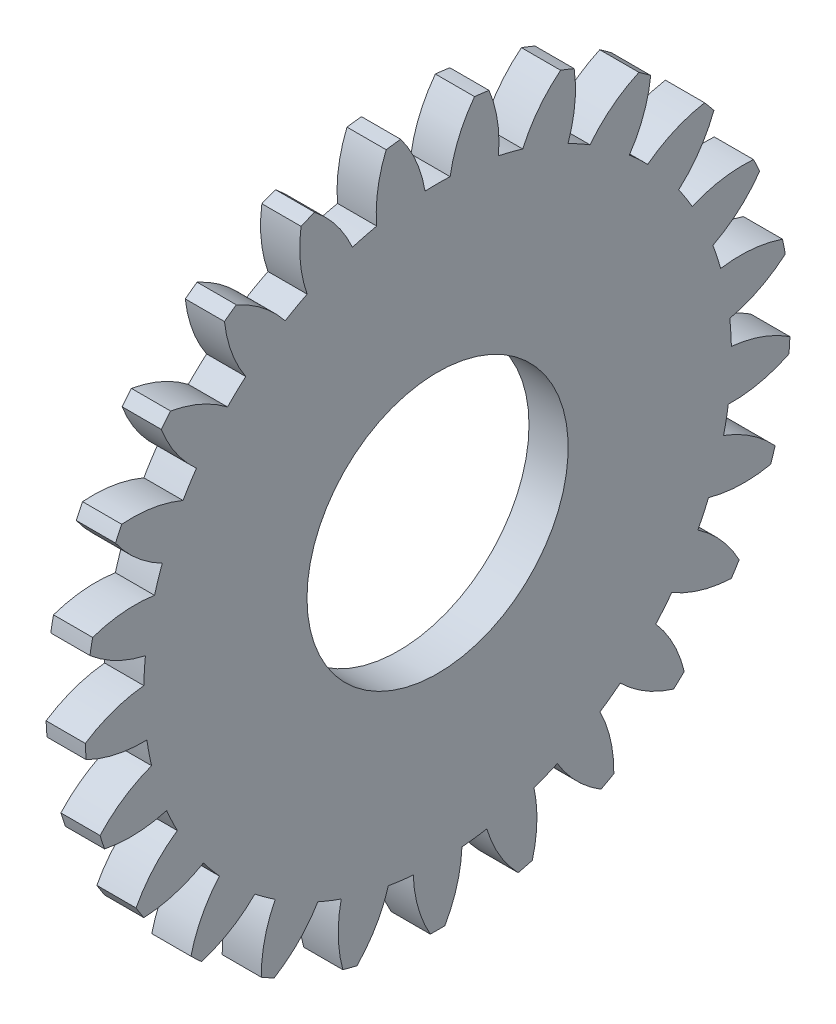
from build123d import *

# Parameters (mm, degrees)
BASPROSKE_W     = 1.5
BASPROSKE_H     = 13.5
TOOTHCUT_DEPTH  = 20.150718002
TEETHCUTS_COUNT = 25
TEETHCUTS_ANGLE = 345.6
BORSKE_R        = 5
BORE_DEPTH      = 50.0000508


with BuildPart() as part:
    # BasProSke → Base-Revolve (revolve)
    with BuildSketch(Plane(origin=(0, 0, 0), x_dir=(1, 0, 0), z_dir=(0, 1, 0)), mode=Mode.PRIVATE) as base_revolve_sk:
        with Locations((0.75, 6.75)):
            Rectangle(BASPROSKE_W, BASPROSKE_H)
    revolve(base_revolve_sk.sketch.rotate(Axis((-10, 0, 0), (1, 0, 0)), 180), axis=Axis((-10, 0, 0), (1, 0, 0)))

    # TooCutSke → ToothCut (cut, through all)
    with BuildSketch(Plane(origin=(0, 0, 0), x_dir=(0, 0, -1), z_dir=(1, 0, 0))):
        with BuildLine():
            ThreePointArc((0.480087995, 11.238750665), (0, 11.249), (-0.480087995, 11.238750665))
            ThreePointArc((-0.480087995, 11.238750665), (-0.821124963, 12.40220054), (-1.432168974, 13.449361962))
            ThreePointArc((-1.432168974, 13.449361962), (0, 13.5254), (1.432168974, 13.449361962))
            ThreePointArc((1.432168974, 13.449361962), (0.821124963, 12.40220054), (0.480087995, 11.238750665))
        make_face()
    toothcut = extrude(amount=TOOTHCUT_DEPTH, mode=Mode.SUBTRACT)

    # TeethCuts: ToothCut ×25 about axis
    teethcuts_axis = Axis((-10, 0, 0), (1, 0, 0))
    for i in range(1, TEETHCUTS_COUNT):
        add(toothcut.rotate(teethcuts_axis, i * TEETHCUTS_ANGLE / (TEETHCUTS_COUNT - 1)), mode=Mode.SUBTRACT)

    # BorSke → Bore (cut, symmetric)
    with BuildSketch(Plane(origin=(0, 0, 0), x_dir=(0, 0, -1), z_dir=(1, 0, 0))):
        with Locations(Location((0, 0, 0), (0, 0, 180))):
            Circle(BORSKE_R)
    extrude(amount=BORE_DEPTH, both=True, mode=Mode.SUBTRACT)


solid = part.part
